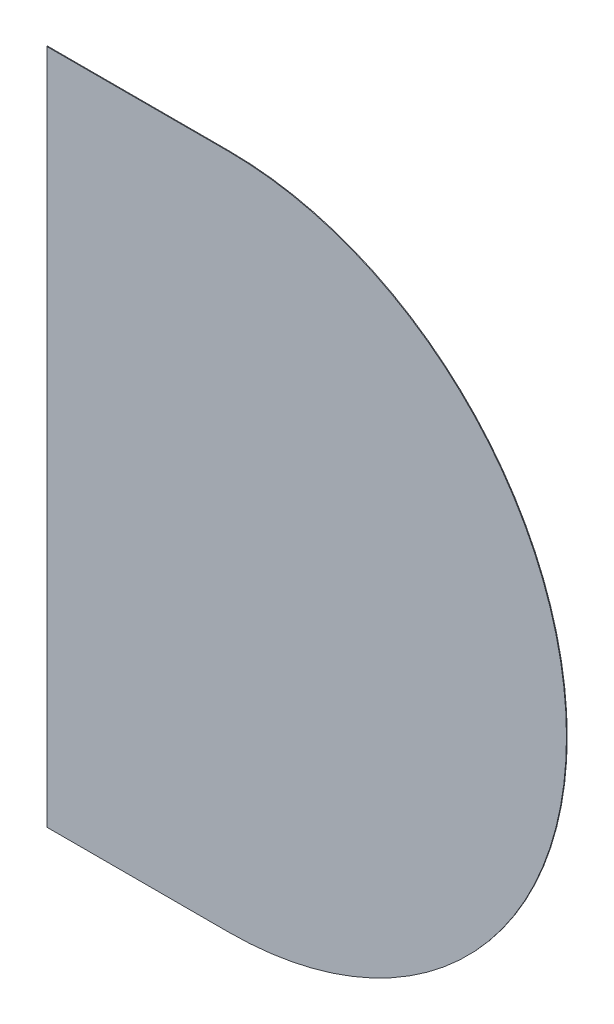
from build123d import *

# Parameters (mm, degrees)
BOSS_EXTRUDE1_DEPTH = 2


with BuildPart() as part:
    # Sketch1 → Boss-Extrude1 (new body)
    with BuildSketch(Plane.XY):
        with BuildLine():
            Line((0, 0), (485, 0))
            ThreePointArc((485, 0), (1387.5, 902.5), (485, 1805))
            Line((485, 1805), (0, 1805))
            Line((0, 1805), (0, 0))
        make_face()
    extrude(amount=BOSS_EXTRUDE1_DEPTH)


solid = part.part
